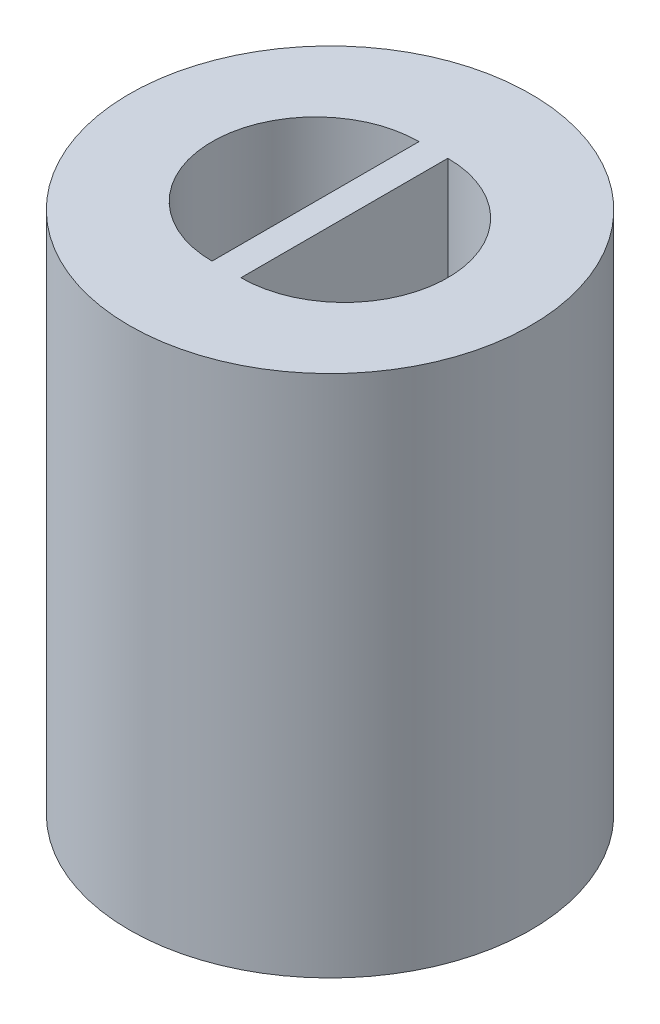
from build123d import *

# Parameters (mm, degrees)
SKETCH1_R           = 5.75
BOSS_EXTRUDE1_DEPTH = 15
CUT_EXTRUDE3_DEPTH  = 8
SKETCH7_W           = 3.7
SKETCH7_H           = 5.5
CUT_EXTRUDE4_DEPTH  = 6.5


with BuildPart() as part:
    # Sketch1 → Boss-Extrude1 (new body)
    with BuildSketch(Plane(origin=(0, 0, 0), x_dir=(1, 0, 0), z_dir=(0, 1, 0))):
        with Locations(Location((0, 0, 0), (0, 0, 270))):
            Circle(SKETCH1_R)
    extrude(amount=BOSS_EXTRUDE1_DEPTH)

    # Sketch6 → Cut-Extrude3 (cut)
    with BuildSketch(Plane(origin=(0, 15, 0), x_dir=(1, 0, 0), z_dir=(0, 1, 0))):
        with BuildLine():
            Line((0.41, 2.964671599), (0.41, -2.964671599))
            ThreePointArc((0.41, -2.964671599), (3.374671599, 0), (0.41, 2.964671599))
        make_face()
        with BuildLine():
            Line((-0.416408681, 2.965564682), (-0.416408681, -2.965564682))
            ThreePointArc((-0.416408681, -2.965564682), (-3.381973363, 0), (-0.416408681, 2.965564682))
        make_face()
    extrude(amount=-CUT_EXTRUDE3_DEPTH, mode=Mode.SUBTRACT)

    # Sketch7 → Cut-Extrude4 (cut)
    with BuildSketch(Plane(origin=(0, 0, 0), x_dir=(1, 0, 0), z_dir=(0, 1, 0))):
        Rectangle(SKETCH7_W, SKETCH7_H)
    extrude(amount=CUT_EXTRUDE4_DEPTH, mode=Mode.SUBTRACT)


solid = part.part
